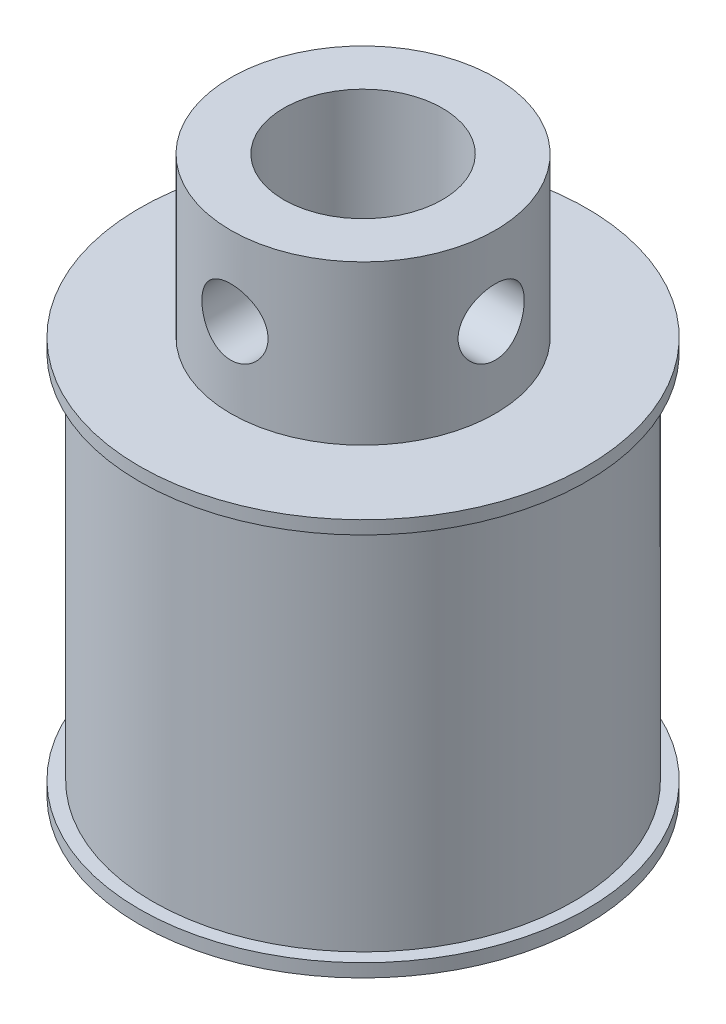
from build123d import *

# Parameters (mm, degrees)
CROQUIS1_R                 = 7.95
SALIENTE_EXTRUIR1_DEPTH    = 7.5
CROQUIS2_R                 = 8.45
SALIENTE_EXTRUIR2_DEPTH    = 0.5
SALIENTE_EXTRUIR3_START    = -14.5
CROQUIS2_2_R               = 8.45
SALIENTE_EXTRUIR3_DEPTH    = 0.5
CROQUIS3_R                 = 5
SALIENTE_EXTRUIR4_DEPTH    = 21
CORTAR_EXTRUIR1_DEPTH      = 24.728779994
CORTAR_EXTRUIR1_DEPTH_BACK = 24.728779994
CROQUIS4_R                 = 3
CROQUIS7_W                 = 1.25
CROQUIS7_H                 = 5
CROQUIS9_W                 = 1.25
CROQUIS9_H                 = 8.45


with BuildPart() as part:
    # Croquis1 → Saliente-Extruir1 (new, symmetric)
    with BuildSketch(Plane(origin=(0, 0, 0), x_dir=(-1, 0, 0), z_dir=(0, 1, 0))):
        with Locations(Location((0, 0, 0), (0, 0, 90))):
            Circle(CROQUIS1_R)
    extrude(amount=SALIENTE_EXTRUIR1_DEPTH, both=True)

    # Croquis2 → Saliente-Extruir2 (add)
    with BuildSketch(Plane(origin=(0, 7.5, 0), x_dir=(-1, 0, 0), z_dir=(0, 1, 0))):
        with Locations(Location((0, 0, 0), (0, 0, 90))):
            Circle(CROQUIS2_R)
    extrude(amount=-SALIENTE_EXTRUIR2_DEPTH)

    # Croquis2<2> → Saliente-Extruir3 (add)
    with BuildSketch(Plane(origin=(0, 7.5, 0), x_dir=(-1, 0, 0), z_dir=(0, 1, 0)).offset(SALIENTE_EXTRUIR3_START)):
        with Locations(Location((0, 0, 0), (0, 0, 90))):
            Circle(CROQUIS2_2_R)
    extrude(amount=-SALIENTE_EXTRUIR3_DEPTH)

    # Croquis3 → Saliente-Extruir4 (add)
    with BuildSketch(Plane(origin=(0, -7.5, 0), x_dir=(-1, 0, 0), z_dir=(0, 1, 0))):
        with Locations(Location((0, 0, 0), (0, 0, 270))):
            Circle(CROQUIS3_R)
    extrude(amount=SALIENTE_EXTRUIR4_DEPTH)

    # Croquis4 → Cortar-Extruir1 (cut, two sides: drawn at the far end of the back side and taken through both)
    with BuildSketch(Plane(origin=(0, -7, 0), x_dir=(-1, 0, 0), z_dir=(0, 1, 0)).offset(-CORTAR_EXTRUIR1_DEPTH_BACK)):
        with Locations(Location((0, 0, 0), (0, 0, 90))):
            Circle(CROQUIS4_R)
    extrude(amount=CORTAR_EXTRUIR1_DEPTH + CORTAR_EXTRUIR1_DEPTH_BACK, mode=Mode.SUBTRACT)

    # Croquis7 → Taladro roscado M32 (revolve, cut)
    with BuildSketch(Plane.ZX.offset(10.5)):
        with Locations((0.625, 2.5)):
            Rectangle(CROQUIS7_W, CROQUIS7_H)
    revolve(axis=Axis((-6.35, 10.5, 0), (1, 0, 0)), mode=Mode.SUBTRACT)

    # Croquis9 → Taladro roscado M31 (revolve, cut)
    with BuildSketch(Plane(origin=(0, 10.5, 0), x_dir=(0, 1, 0), z_dir=(1, 0, 0))):
        with Locations((0.625, 4.225)):
            Rectangle(CROQUIS9_W, CROQUIS9_H)
    revolve(axis=Axis((0, 10.5, -6.35), (0, 0, 1)), mode=Mode.SUBTRACT)


solid = part.part
